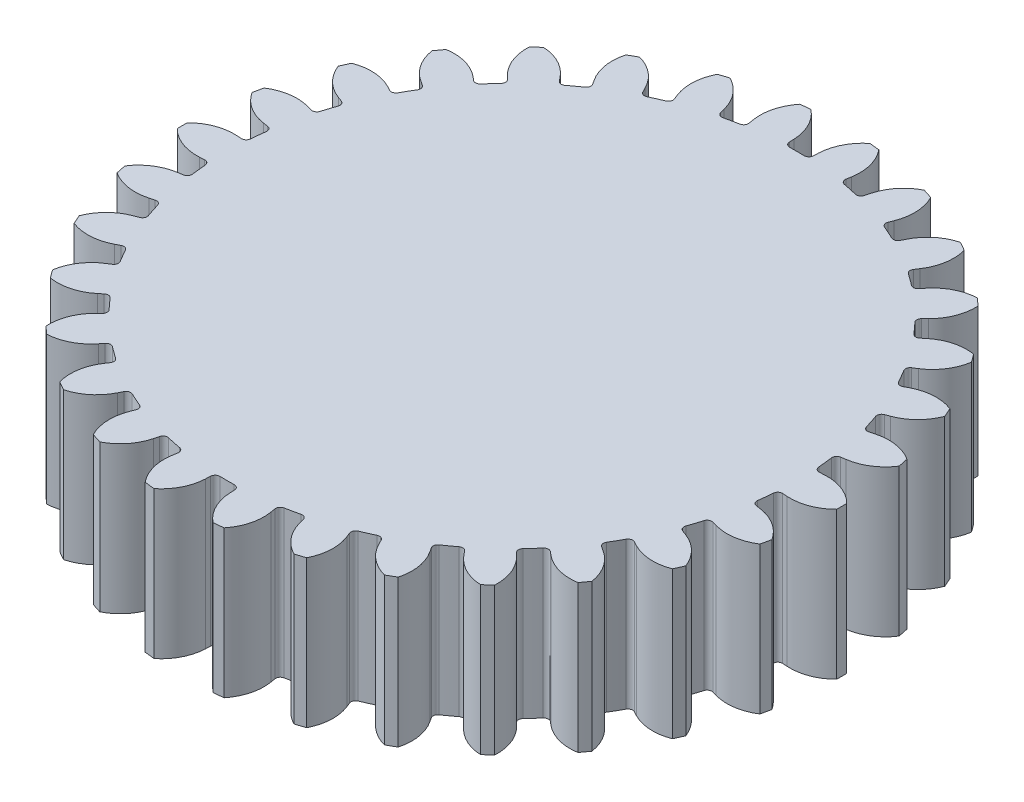
from build123d import *

# Parameters (mm, degrees)
SKETCH1_R                = 7.112
BOSS_EXTRUDE1_DEPTH      = 3.175
CUT_EXTRUDE3_DEPTH       = 11.547118706
FILLET1_R                = 0.1016
CIRPATTERN3_COUNT        = 30
FILLET1_OF_CIRPATTERN3_R = 0.1016
SKETCH5_W                = 3.81
SKETCH5_H                = 3.81
CUT_EXTRUDE2_DEPTH       = 1.27


with BuildPart() as part:
    # Sketch1 → Boss-Extrude1 (new body)
    with BuildSketch(Plane(origin=(0, 0, 0), x_dir=(1, 0, 0), z_dir=(0, 1, 0))):
        Circle(SKETCH1_R)
    extrude(amount=BOSS_EXTRUDE1_DEPTH)

    # Sketch8 → Cut-Extrude3 (cut, through all)
    with BuildSketch(Plane(origin=(0, 3.175, 0), x_dir=(1, 0, 0), z_dir=(0, 1, 0))):
        with BuildLine():
            Line((-0.262396694, 6.344576264), (-0.254, 6.141549824))
            ThreePointArc((-0.254, 6.141549824), (0, 6.1468), (0.254, 6.141549824))
            Line((0.254, 6.141549824), (0.262396694, 6.344576264))
            ThreePointArc((0.262396694, 6.344576264), (0.368846887, 6.754345692), (0.635, 7.083595062))
            ThreePointArc((0.635, 7.083595062), (0, 7.112), (-0.635, 7.083595062))
            ThreePointArc((-0.635, 7.083595062), (-0.368846887, 6.754345692), (-0.262396694, 6.344576264))
        make_face()
    cut_extrude3 = extrude(amount=-CUT_EXTRUDE3_DEPTH, mode=Mode.SUBTRACT)

    # Fillet1
    fillet1_edges = [part.edges().sort_by_distance(p)[0] for p in [
        (0.254, 1.5875, -6.141549824),
        (-0.254, 1.5875, -6.141549824),
    ]]
    fillet(fillet1_edges, radius=FILLET1_R)

    # CirPattern3: Cut-Extrude3 ×30 about axis
    cirpattern3_axis = Axis((0, 3.175, 0), (0, -1, 0))
    for i in range(1, CIRPATTERN3_COUNT):
        add(cut_extrude3.rotate(cirpattern3_axis, i * 360 / CIRPATTERN3_COUNT), mode=Mode.SUBTRACT)

    # Fillet1 of CirPattern3
    fillet1_of_cirpattern3_edges = [part.edges().sort_by_distance(p)[0] for p in [
        (1.525349499, 1.5875, -5.954532656),
        (1.028450518, 1.5875, -6.060151795),
        (2.730033905, 1.5875, -5.507273837),
        (2.265952812, 1.5875, -5.713896052),
        (3.815402729, 1.5875, -4.819320725),
        (3.404422096, 1.5875, -5.117915633),
        (4.734020146, 1.5875, -3.920740172),
        (4.394101798, 1.5875, -4.298257743),
        (5.445738166, 1.5875, -2.850804459),
        (5.191738166, 1.5875, -3.290745365),
        (5.919451297, 1.5875, -1.656274912),
        (5.762470664, 1.5875, -2.139411623),
        (6.134456001, 1.5875, -0.389358204),
        (6.081355542, 1.5875, -0.894575327),
        (6.081355542, 1.5875, 0.894575327),
        (6.134456001, 1.5875, 0.389358204),
        (5.762470664, 1.5875, 2.139411623),
        (5.919451297, 1.5875, 1.656274912),
        (5.191738166, 1.5875, 3.290745365),
        (5.445738166, 1.5875, 2.850804459),
        (4.394101798, 1.5875, 4.298257743),
        (4.734020146, 1.5875, 3.920740172),
        (3.404422096, 1.5875, 5.117915633),
        (3.815402729, 1.5875, 4.819320725),
        (2.265952812, 1.5875, 5.713896052),
        (2.730033905, 1.5875, 5.507273837),
        (1.028450518, 1.5875, 6.060151795),
        (1.525349499, 1.5875, 5.954532656),
        (-0.254, 1.5875, 6.141549824),
        (0.254, 1.5875, 6.141549824),
        (-1.525349499, 1.5875, 5.954532656),
        (-1.028450518, 1.5875, 6.060151795),
        (-2.730033905, 1.5875, 5.507273837),
        (-2.265952812, 1.5875, 5.713896052),
        (-3.815402729, 1.5875, 4.819320725),
        (-3.404422096, 1.5875, 5.117915633),
        (-4.734020146, 1.5875, 3.920740172),
        (-4.394101798, 1.5875, 4.298257743),
        (-5.445738166, 1.5875, 2.850804459),
        (-5.191738166, 1.5875, 3.290745365),
        (-5.919451297, 1.5875, 1.656274912),
        (-5.762470664, 1.5875, 2.139411623),
        (-6.134456001, 1.5875, 0.389358204),
        (-6.081355542, 1.5875, 0.894575327),
        (-6.081355542, 1.5875, -0.894575327),
        (-6.134456001, 1.5875, -0.389358204),
        (-5.762470664, 1.5875, -2.139411623),
        (-5.919451297, 1.5875, -1.656274912),
        (-5.191738166, 1.5875, -3.290745365),
        (-5.445738166, 1.5875, -2.850804459),
        (-4.394101798, 1.5875, -4.298257743),
        (-4.734020146, 1.5875, -3.920740172),
        (-3.404422096, 1.5875, -5.117915633),
        (-3.815402729, 1.5875, -4.819320725),
        (-2.265952812, 1.5875, -5.713896052),
        (-2.730033905, 1.5875, -5.507273837),
        (-1.028450518, 1.5875, -6.060151795),
        (-1.525349499, 1.5875, -5.954532656),
    ]]
    fillet(fillet1_of_cirpattern3_edges, radius=FILLET1_OF_CIRPATTERN3_R)

    # Sketch5 → Cut-Extrude2 (cut)
    with BuildSketch(Plane.XZ):
        Rectangle(SKETCH5_W, SKETCH5_H)
    extrude(amount=-CUT_EXTRUDE2_DEPTH, mode=Mode.SUBTRACT)


solid = part.part
